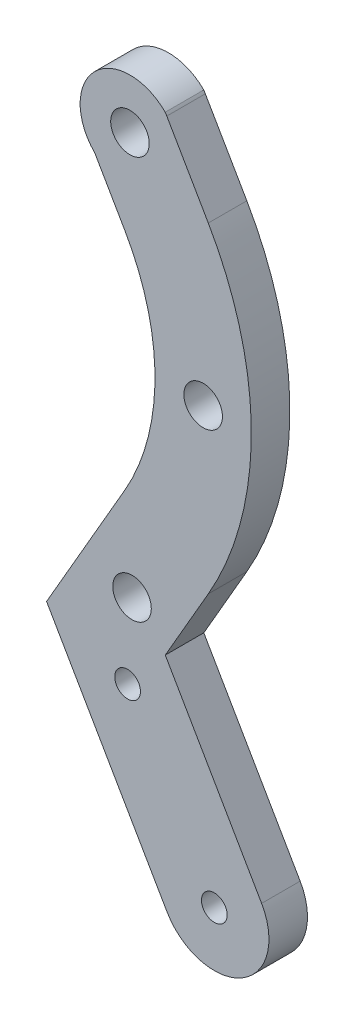
from build123d import *

# Parameters (mm, degrees)
SKETCH1_R           = 3
SKETCH1_R_2         = 2
BOSS_EXTRUDE1_DEPTH = 6


with BuildPart() as part:
    # Sketch1 → Boss-Extrude1 (new body)
    with BuildSketch(Plane.XY):
        with BuildLine():
            ThreePointArc((24.40844793, 25.621778265), (24.40844793, 36.592231664), (35.378901329, 36.592231664))
            ThreePointArc((35.378901329, 36.592231664), (35.506003821, 36.393205072), (35.627115001, 36.190476904))
            Line((35.627115001, 36.190476904), (42.087939854, 25))
            ThreePointArc((42.087939854, 25), (48.786669665, 0), (42.087939854, -25))
            Line((42.087939854, -25), (35.389210043, -36.602540378))
            Line((35.389210043, -36.602540378), (50.389210043, -62.583302492))
            ThreePointArc((50.389210043, -62.583302492), (47.276233722, -74.201088285), (35.65844793, -71.088111964))
            Line((35.65844793, -71.088111964), (33.905802512, -68.052441052))
            Line((33.905802512, -68.052441052), (16.90844793, -38.612159322))
            Line((16.90844793, -38.612159322), (24.40844793, -25.621778265))
            Line((24.40844793, -25.621778265), (29.097558797, -17.5))
            ThreePointArc((29.097558797, -17.5), (33.786669665, 0), (29.097558797, 17.5))
            Line((29.097558797, 17.5), (24.40844793, 25.621778265))
        make_face()
        with Locations((29.893674629, 31.107004965)):
            Circle(SKETCH1_R, mode=Mode.SUBTRACT)
        with Locations((30.212002479, -31.425332814)):
            Circle(SKETCH1_R, mode=Mode.SUBTRACT)
        with Locations((43.023828987, -66.835707228)):
            Circle(SKETCH1_R_2, mode=Mode.SUBTRACT)
        with Locations((41.286669665, 0)):
            Circle(SKETCH1_R, mode=Mode.SUBTRACT)
        with Locations((29.523828987, -43.453021326)):
            Circle(SKETCH1_R_2, mode=Mode.SUBTRACT)
    extrude(amount=BOSS_EXTRUDE1_DEPTH)


solid = part.part
